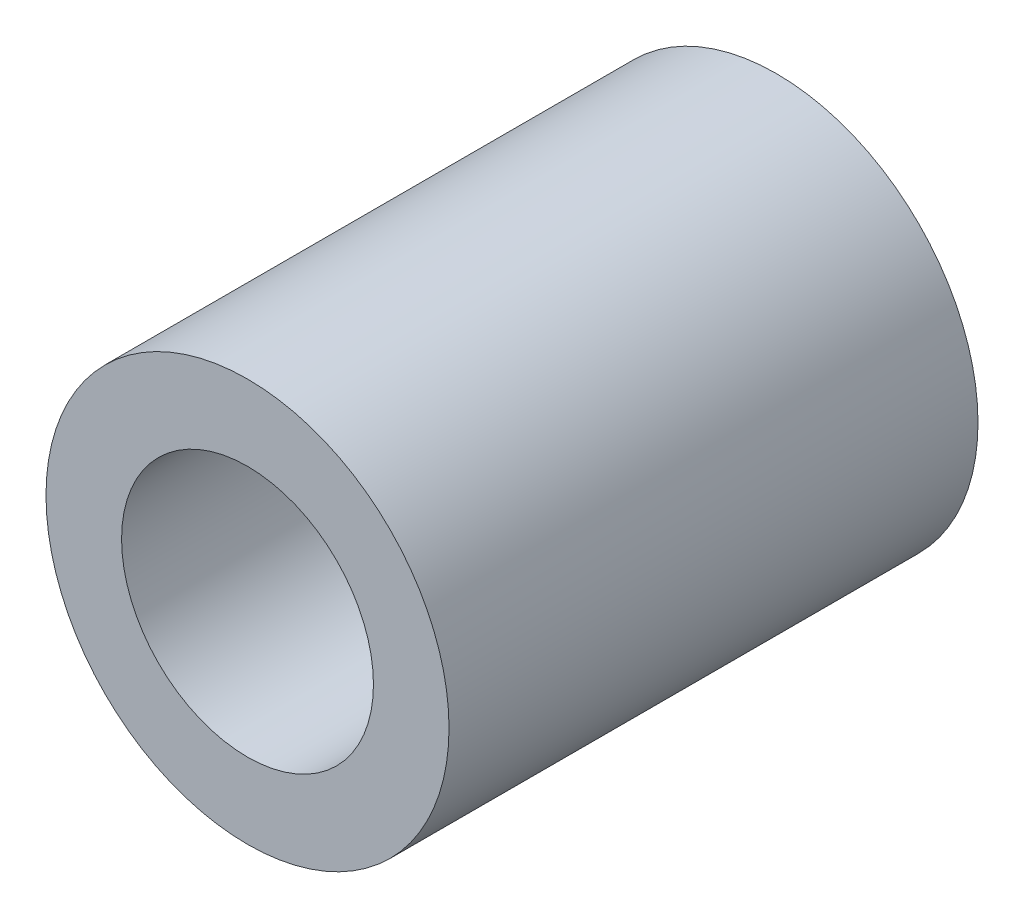
from build123d import *

# Parameters (mm, degrees)
SKETCH_1_R      = 16
SKETCH_1_R_2    = 10
EXTRUDE_1_DEPTH = 21


with BuildPart() as part:
    # 草图1 → 凸台-拉伸1 (new, symmetric)
    with BuildSketch(Plane.XY):
        with Locations(Location((0, 0, 0), (0, 0, 180))):
            Circle(SKETCH_1_R)
        with Locations(Location((0, 0, 0), (0, 0, 180))):
            Circle(SKETCH_1_R_2, mode=Mode.SUBTRACT)
    extrude(amount=EXTRUDE_1_DEPTH, both=True)


solid = part.part
